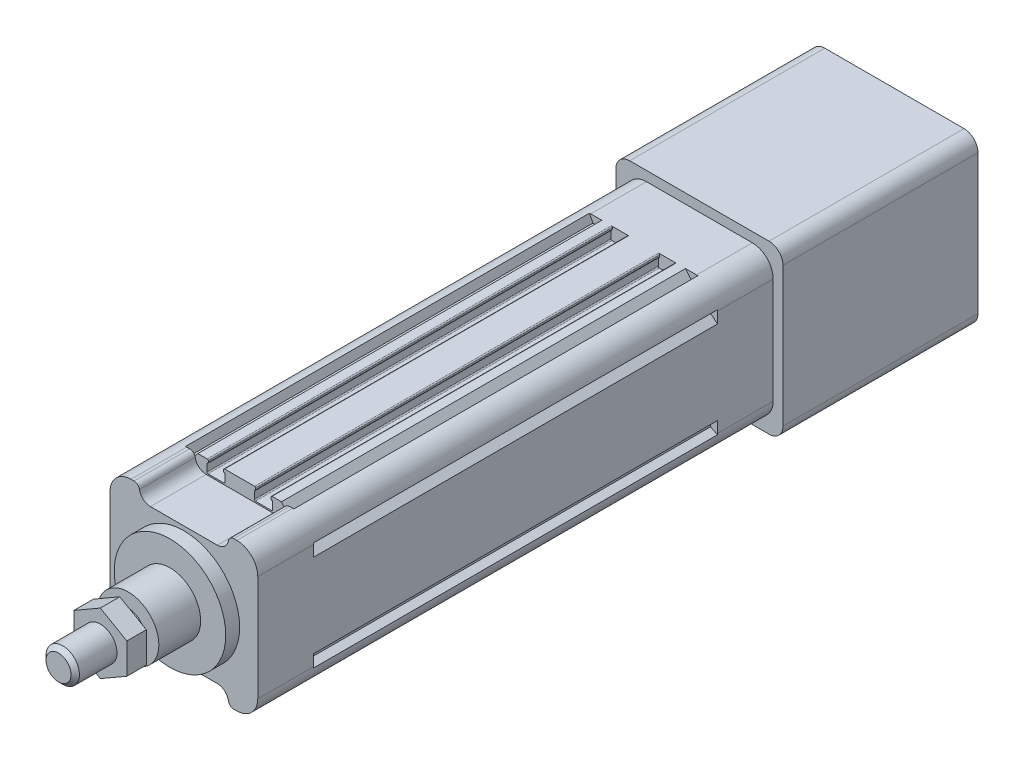
from build123d import *

# Parameters (mm, degrees)
SKETCH_1_R             = 2.1
EXTRUDE_1_DEPTH        = 145
EXTRUDE_2_DEPTH        = 20
SKETCH_7_R             = 20
EXTRUDE_3_DEPTH        = 5
SKETCH_9_R             = 11
EXTRUDE_4_DEPTH        = 15
SKETCH_10_R            = 6
EXTRUDE_5_DEPTH        = 25
EXTRUDE_START          = 20
EXTRUDE_6_DEPTH        = 20
EXTRUDE_7_DEPTH        = 70
SKETCH_14_R            = 19
CUT_EXTRUDE_2_DEPTH    = 70
HOLE_WIZARD_M6_1_D     = 5
HOLE_WIZARD_M6_1_DEPTH = 15
HOLE_WIZARD_M6_1_TIP   = 1.502151548
CHAMFER_1_SIZE         = 1.5
EXTRUDE_START_2        = 3
EXTRUDE_8_DEPTH        = 7


with BuildPart() as part:
    # 草图1 → 凸台-拉伸1 (new body)
    with BuildSketch(Plane.XY):
        with BuildLine():
            Line((-18.2, 24), (-19.443439638, 26.486879276))
            ThreePointArc((-19.443439638, 26.486879276), (-24.303300859, 24.303300859), (-26.486879276, 19.443439638))
            Line((-26.486879276, 19.443439638), (-24, 18.2))
            Line((-24, 18.2), (-24, 17.1))
            Line((-24, 17.1), (-26.5, 15))
            Line((-26.5, 15), (-26.5, -15))
            Line((-26.5, -15), (-24, -17.1))
            Line((-24, -17.1), (-24, -18.2))
            Line((-24, -18.2), (-26.486879276, -19.443439638))
            ThreePointArc((-26.486879276, -19.443439638), (-24.303300859, -24.303300859), (-19.443439638, -26.486879276))
            Line((-19.443439638, -26.486879276), (-18.2, -24))
            Line((-18.2, -24), (-17.1, -24))
            Line((-17.1, -24), (-15, -26.5))
            Line((-15, -26.5), (-11.65, -26.5))
            ThreePointArc((-11.65, -26.5), (-11.367157288, -26.382842712), (-11.25, -26.1))
            Line((-11.25, -26.1), (-11.25, -25.6))
            ThreePointArc((-11.25, -25.6), (-11.367157288, -25.317157288), (-11.65, -25.2))
            Line((-11.65, -25.2), (-11.75, -25.2))
            Line((-11.75, -25.2), (-11.75, -22.4))
            ThreePointArc((-11.75, -22.4), (-11.632842712, -22.117157288), (-11.35, -22))
            Line((-11.35, -22), (-5.65, -22))
            ThreePointArc((-5.65, -22), (-5.367157288, -22.117157288), (-5.25, -22.4))
            Line((-5.25, -22.4), (-5.25, -25.2))
            Line((-5.25, -25.2), (-5.35, -25.2))
            ThreePointArc((-5.35, -25.2), (-5.632842712, -25.317157288), (-5.75, -25.6))
            Line((-5.75, -25.6), (-5.75, -26.1))
            ThreePointArc((-5.75, -26.1), (-5.632842712, -26.382842712), (-5.35, -26.5))
            Line((-5.35, -26.5), (5.35, -26.5))
            ThreePointArc((5.35, -26.5), (5.632842712, -26.382842712), (5.75, -26.1))
            Line((5.75, -26.1), (5.75, -25.6))
            ThreePointArc((5.75, -25.6), (5.632842712, -25.317157288), (5.35, -25.2))
            Line((5.35, -25.2), (5.25, -25.2))
            Line((5.25, -25.2), (5.25, -22.4))
            ThreePointArc((5.25, -22.4), (5.367157288, -22.117157288), (5.65, -22))
            Line((5.65, -22), (11.35, -22))
            ThreePointArc((11.35, -22), (11.632842712, -22.117157288), (11.75, -22.4))
            Line((11.75, -22.4), (11.75, -25.2))
            Line((11.75, -25.2), (11.65, -25.2))
            ThreePointArc((11.65, -25.2), (11.367157288, -25.317157288), (11.25, -25.6))
            Line((11.25, -25.6), (11.25, -26.1))
            ThreePointArc((11.25, -26.1), (11.367157288, -26.382842712), (11.65, -26.5))
            Line((11.65, -26.5), (15, -26.5))
            Line((15, -26.5), (17.1, -24))
            Line((17.1, -24), (18.2, -24))
            Line((18.2, -24), (19.443439638, -26.486879276))
            ThreePointArc((19.443439638, -26.486879276), (24.303300859, -24.303300859), (26.486879276, -19.443439638))
            Line((26.486879276, -19.443439638), (24, -18.2))
            Line((24, -18.2), (24, -17.1))
            Line((24, -17.1), (26.5, -15))
            Line((26.5, -15), (26.5, 15))
            Line((26.5, 15), (24, 17.1))
            Line((24, 17.1), (24, 18.2))
            Line((24, 18.2), (26.486879276, 19.443439638))
            ThreePointArc((26.486879276, 19.443439638), (24.303300859, 24.303300859), (19.443439638, 26.486879276))
            Line((19.443439638, 26.486879276), (18.2, 24))
            Line((18.2, 24), (17.1, 24))
            Line((17.1, 24), (15, 26.5))
            Line((15, 26.5), (11.65, 26.5))
            ThreePointArc((11.65, 26.5), (11.367157288, 26.382842712), (11.25, 26.1))
            Line((11.25, 26.1), (11.25, 25.6))
            ThreePointArc((11.25, 25.6), (11.367157288, 25.317157288), (11.65, 25.2))
            Line((11.65, 25.2), (11.75, 25.2))
            Line((11.75, 25.2), (11.75, 22.4))
            ThreePointArc((11.75, 22.4), (11.632842712, 22.117157288), (11.35, 22))
            Line((11.35, 22), (5.65, 22))
            ThreePointArc((5.65, 22), (5.367157288, 22.117157288), (5.25, 22.4))
            Line((5.25, 22.4), (5.25, 25.2))
            Line((5.25, 25.2), (5.35, 25.2))
            ThreePointArc((5.35, 25.2), (5.632842712, 25.317157288), (5.75, 25.6))
            Line((5.75, 25.6), (5.75, 26.1))
            ThreePointArc((5.75, 26.1), (5.632842712, 26.382842712), (5.35, 26.5))
            Line((5.35, 26.5), (-5.35, 26.5))
            ThreePointArc((-5.35, 26.5), (-5.632842712, 26.382842712), (-5.75, 26.1))
            Line((-5.75, 26.1), (-5.75, 25.6))
            ThreePointArc((-5.75, 25.6), (-5.632842712, 25.317157288), (-5.35, 25.2))
            Line((-5.35, 25.2), (-5.25, 25.2))
            Line((-5.25, 25.2), (-5.25, 22.4))
            ThreePointArc((-5.25, 22.4), (-5.367157288, 22.117157288), (-5.65, 22))
            Line((-5.65, 22), (-11.35, 22))
            ThreePointArc((-11.35, 22), (-11.632842712, 22.117157288), (-11.75, 22.4))
            Line((-11.75, 22.4), (-11.75, 25.2))
            Line((-11.75, 25.2), (-11.65, 25.2))
            ThreePointArc((-11.65, 25.2), (-11.367157288, 25.317157288), (-11.25, 25.6))
            Line((-11.25, 25.6), (-11.25, 26.1))
            ThreePointArc((-11.25, 26.1), (-11.367157288, 26.382842712), (-11.65, 26.5))
            Line((-11.65, 26.5), (-15, 26.5))
            Line((-15, 26.5), (-17.1, 24))
            Line((-17.1, 24), (-18.2, 24))
        make_face()
        with Locations((19, 19)):
            Circle(SKETCH_1_R, mode=Mode.SUBTRACT)
        with Locations((19, -19)):
            Circle(SKETCH_1_R, mode=Mode.SUBTRACT)
        with Locations((-19, -19)):
            Circle(SKETCH_1_R, mode=Mode.SUBTRACT)
        with Locations((-19, 19)):
            Circle(SKETCH_1_R, mode=Mode.SUBTRACT)
        with BuildLine():
            Line((19.773719933, 3), (23.3, 3))
            Line((23.3, 3), (23.3, -3))
            Line((23.3, -3), (19.773719933, -3))
            ThreePointArc((19.773719933, -3), (0, -20), (-19.773719933, -3))
            Line((-19.773719933, -3), (-23.3, -3))
            Line((-23.3, -3), (-23.3, 3))
            Line((-23.3, 3), (-19.773719933, 3))
            ThreePointArc((-19.773719933, 3), (0, 20), (19.773719933, 3))
        make_face(mode=Mode.SUBTRACT)
    extrude(amount=EXTRUDE_1_DEPTH)

    # 草图6 → 凸台-拉伸2 (add)
    with BuildSketch(Plane.XY.offset(145)):
        with BuildLine():
            Line((-26.5, -19), (-26.5, 19))
            ThreePointArc((-26.5, 19), (-24.303300859, 24.303300859), (-19, 26.5))
            Line((-19, 26.5), (-17.916079783, 26.5))
            ThreePointArc((-17.916079783, 26.5), (-16.625085334, 26.027525232), (-15.944053189, 24.833333333))
            ThreePointArc((-15.944053189, 24.833333333), (-14.581988897, 22.444949537), (-12, 21.5))
            Line((-12, 21.5), (12, 21.5))
            ThreePointArc((12, 21.5), (14.581988897, 22.444949537), (15.944053189, 24.833333333))
            ThreePointArc((15.944053189, 24.833333333), (16.625085334, 26.027525232), (17.916079783, 26.5))
            Line((17.916079783, 26.5), (19, 26.5))
            ThreePointArc((19, 26.5), (24.303300859, 24.303300859), (26.5, 19))
            Line((26.5, 19), (26.5, -19))
            ThreePointArc((26.5, -19), (24.303300859, -24.303300859), (19, -26.5))
            Line((19, -26.5), (17.916079783, -26.5))
            ThreePointArc((17.916079783, -26.5), (16.625085334, -26.027525232), (15.944053189, -24.833333333))
            ThreePointArc((15.944053189, -24.833333333), (14.581988897, -22.444949537), (12, -21.5))
            Line((12, -21.5), (-12, -21.5))
            ThreePointArc((-12, -21.5), (-14.581988897, -22.444949537), (-15.944053189, -24.833333333))
            ThreePointArc((-15.944053189, -24.833333333), (-16.625085334, -26.027525232), (-17.916079783, -26.5))
            Line((-17.916079783, -26.5), (-19, -26.5))
            ThreePointArc((-19, -26.5), (-24.303300859, -24.303300859), (-26.5, -19))
        make_face()
    extrude(amount=EXTRUDE_2_DEPTH)

    # 草图7 → 凸台-拉伸3 (add)
    with BuildSketch(Plane.XY.offset(165)):
        Circle(SKETCH_7_R)
    extrude(amount=EXTRUDE_3_DEPTH)

    # 草图9 → 凸台-拉伸4 (add)
    with BuildSketch(Plane.XY.offset(170)):
        Circle(SKETCH_9_R)
    extrude(amount=EXTRUDE_4_DEPTH)

    # 草图10 → 凸台-拉伸5 (add)
    with BuildSketch(Plane.XY.offset(185)):
        Circle(SKETCH_10_R)
    extrude(amount=EXTRUDE_5_DEPTH)

    # 草图11 → 凸台-拉伸6 (add)
    with BuildSketch(Plane(origin=(0, 0, 0), x_dir=(-1, 0, 0), z_dir=(0, 0, -1)).offset(EXTRUDE_START)):
        with BuildLine():
            Line((-19, -26.5), (19, -26.5))
            ThreePointArc((19, -26.5), (24.303300859, -24.303300859), (26.5, -19))
            Line((26.5, -19), (26.5, 19))
            ThreePointArc((26.5, 19), (24.303300859, 24.303300859), (19, 26.5))
            Line((19, 26.5), (-19, 26.5))
            ThreePointArc((-19, 26.5), (-24.303300859, 24.303300859), (-26.5, 19))
            Line((-26.5, 19), (-26.5, -19))
            ThreePointArc((-26.5, -19), (-24.303300859, -24.303300859), (-19, -26.5))
        make_face()
    extrude(amount=-EXTRUDE_6_DEPTH)

    # 草图12 → 凸台-拉伸7 (add)
    with BuildSketch(Plane(origin=(0, 0, -20), x_dir=(-1, 0, 0), z_dir=(0, 0, -1))):
        with BuildLine():
            Line((-25, -30), (25, -30))
            ThreePointArc((25, -30), (28.535533906, -28.535533906), (30, -25))
            Line((30, -25), (30, 25))
            ThreePointArc((30, 25), (28.535533906, 28.535533906), (25, 30))
            Line((25, 30), (-25, 30))
            ThreePointArc((-25, 30), (-28.535533906, 28.535533906), (-30, 25))
            Line((-30, 25), (-30, -25))
            ThreePointArc((-30, -25), (-28.535533906, -28.535533906), (-25, -30))
        make_face()
    extrude(amount=EXTRUDE_7_DEPTH)

    # 草图14 → 切除-拉伸2 (cut)
    with BuildSketch(Plane(origin=(0, 0, -90), x_dir=(-1, 0, 0), z_dir=(0, 0, -1))):
        Circle(SKETCH_14_R)
    extrude(amount=-CUT_EXTRUDE_2_DEPTH, mode=Mode.SUBTRACT)

    # M6 螺纹孔1
    with Locations(Plane.ZY.offset(26.5)):
        with Locations((155, 11), (155, -11), (-10, 11), (-10, -11)):
            Hole(HOLE_WIZARD_M6_1_D / 2, depth=HOLE_WIZARD_M6_1_DEPTH)
            with Locations((0, 0, -(HOLE_WIZARD_M6_1_DEPTH + HOLE_WIZARD_M6_1_TIP / 2))):  # 118° drill point
                Cone(0, HOLE_WIZARD_M6_1_D / 2, HOLE_WIZARD_M6_1_TIP, mode=Mode.SUBTRACT)

    # 倒角1
    chamfer_1_edges = [part.edges().sort_by_distance(p)[0] for p in [
        (-6, 0, 210),
    ]]
    chamfer(chamfer_1_edges, length=CHAMFER_1_SIZE)

    # 草图17 → 凸台-拉伸8 (add)
    with BuildSketch(Plane.XY.offset(185).offset(EXTRUDE_START_2)):
        Polygon((0, 10.969655115), (-9.5, 5.484827557), (-9.5, -5.484827557), (0, -10.969655115), (9.5, -5.484827557), (9.5, 5.484827557), align=None)
    extrude(amount=EXTRUDE_8_DEPTH)


solid = part.part
